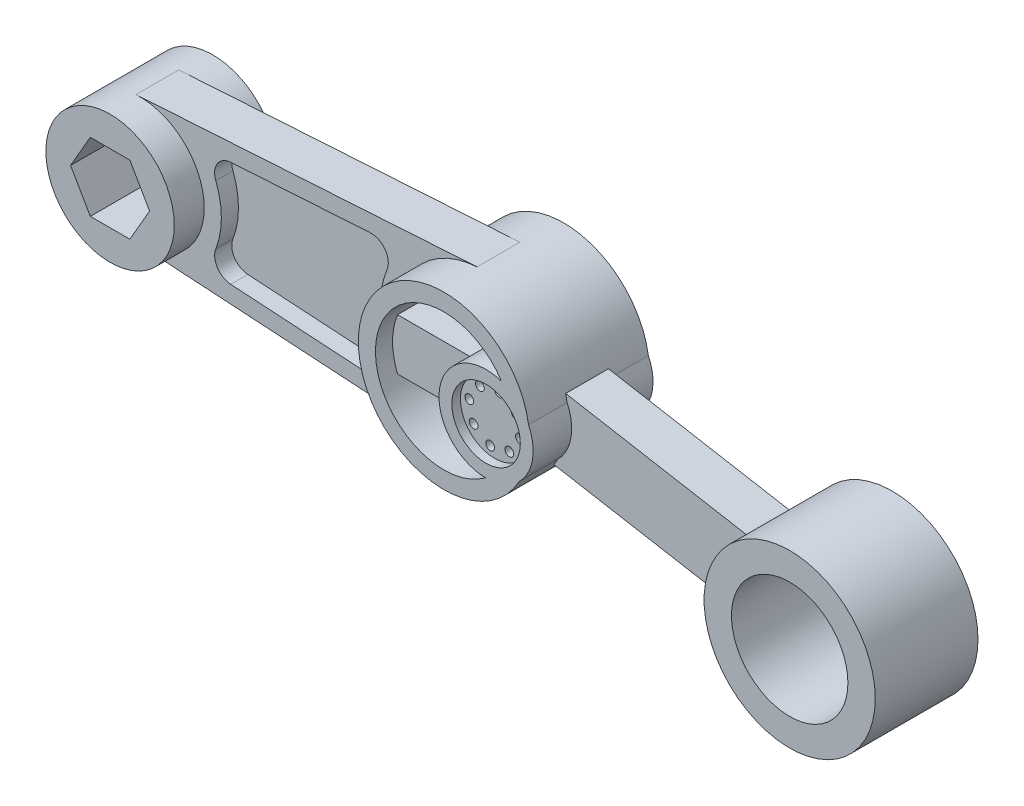
from build123d import *
from build123d.topology import SkipClean

# Parameters (mm, degrees)
LEFT_ARM_DEPTH                = 12.5
SKETCH2_R                     = 37.5
LEFT_BOSS_DEPTH               = 30
LEFT_HEX_DEPTH                = 262.916017
LEFT_HEX_DEPTH_BACK           = 262.916017
SKETCH3_R                     = 50
CENTRE_BOSS_DEPTH             = 35
SKETCH5_W                     = 25
SKETCH5_H                     = 40
RIGHT_ARM_DEPTH               = 200
SKETCH7_R                     = 50
RIGHT_BOSS_DEPTH              = 30
SKETCH8_R                     = 34
RIGHT_BOSS_HOLE_DEPTH         = 460.541879
SKETCH9_R                     = 40
CENTRE_HOLE_DEPTH             = 461.27572
SKETCH10_R                    = 27.5
CENTRE_BLOB_DEPTH             = 35
CENTRE_BEAM_REACH             = 265.428
SKETCH11_W                    = 50
SKETCH11_H                    = 30
CENTRE_BEAM_DIRECTION_2_REACH = 265.428
SKETCH12_R                    = 20
CUT_EXTRUDE4_DEPTH            = 5
F_1_4_20_TAPPED_HOLE1_D       = 5.1054
CIRPATTERN1_COUNT             = 8
CUT_OUT_DEPTH                 = 10
FILLET1_R                     = 10
FILLET1_OF_MIRROR2_R          = 10


with BuildPart() as part:
    # Sketch1 → LEFT_ARM (new, symmetric)
    with BuildSketch(Plane.XY):
        with BuildLine():
            Line((-2.34375, 37.426686), (196.875, 49.902248))
            ThreePointArc((196.875, 49.902248), (250, 0), (196.875, -49.902248))
            Line((196.875, -49.902248), (-2.34375, -37.426686))
            ThreePointArc((-2.34375, -37.426686), (-37.5, 0), (-2.34375, 37.426686))
        make_face()
    extrude(amount=LEFT_ARM_DEPTH, both=True)

    # Sketch2 → LEFT_Boss (add, symmetric)
    with SkipClean():  # the faces are left unmerged after this step: merging them gives an invalid solid
        with BuildSketch(Plane.XY):
            Circle(SKETCH2_R)
        extrude(amount=LEFT_BOSS_DEPTH, both=True)

    # Sketch4 → LEFT_Hex (cut, two sides: drawn at the far end of the back side and taken through both)
    with SkipClean():  # the faces are left unmerged after this step: merging them gives an invalid solid
        with BuildSketch(Plane.XY.offset(30).offset(-LEFT_HEX_DEPTH_BACK)):
            Polygon((23.094011, 0), (11.547005, 20), (-11.547005, 20), (-23.094011, 0), (-11.547005, -20), (11.547005, -20), align=None)
        extrude(amount=LEFT_HEX_DEPTH + LEFT_HEX_DEPTH_BACK, mode=Mode.SUBTRACT)

    # Sketch3 → CENTRE_Boss (add, symmetric)
    with SkipClean():  # the faces are left unmerged after this step: merging them gives an invalid solid
        with BuildSketch(Plane.XY):
            with Locations((200, 0)):
                Circle(SKETCH3_R)
        extrude(amount=CENTRE_BOSS_DEPTH, both=True)

    # Sketch5 → RIGHT_ARM (add)
    with SkipClean():  # the faces are left unmerged after this step: merging them gives an invalid solid
        with BuildSketch(Plane(origin=(193.969262, -34.202014, 0), x_dir=(0, 0, -1), z_dir=(0.984807753012208, -0.17364817766693072, 0))):
            with Locations((0, 34.729636)):
                Rectangle(SKETCH5_W, SKETCH5_H)
        extrude(amount=RIGHT_ARM_DEPTH)

    # Sketch7 → RIGHT_Boss (add, symmetric)
    with SkipClean():  # the faces are left unmerged after this step: merging them gives an invalid solid
        with BuildSketch(Plane.XY):
            with Locations((396.961551, -34.729636)):
                Circle(SKETCH7_R)
        extrude(amount=RIGHT_BOSS_DEPTH, both=True)

    # Sketch8 → RIGHT_Boss_Hole (cut, through all)
    with SkipClean():  # the faces are left unmerged after this step: merging them gives an invalid solid
        with BuildSketch(Plane.XY.offset(30)):
            with Locations((396.961551, -34.729636)):
                Circle(SKETCH8_R)
        extrude(amount=-RIGHT_BOSS_HOLE_DEPTH, mode=Mode.SUBTRACT)

    # Sketch9 → CENTRE_Hole (cut, through all)
    with SkipClean():  # the faces are left unmerged after this step: merging them gives an invalid solid
        with BuildSketch(Plane.XY.offset(35)):
            with Locations((200, 0)):
                Circle(SKETCH9_R)
        extrude(amount=-CENTRE_HOLE_DEPTH, mode=Mode.SUBTRACT)

    # Sketch10 → CENTRE_Blob (add, symmetric)
    with SkipClean():  # the faces are left unmerged after this step: merging them gives an invalid solid
        with BuildSketch(Plane.XY):
            with Locations((224.620194, -4.341204)):
                Circle(SKETCH10_R)
        extrude(amount=CENTRE_BLOB_DEPTH, both=True)

    # Sketch11 → CENTRE_Beam (add, up to next)
    with BuildSketch(Plane(origin=(200, 0, 0), x_dir=(0, 0, -1), z_dir=(1, 0, 0)), mode=Mode.PRIVATE) as centre_beam_sk1:
        Rectangle(SKETCH11_W, SKETCH11_H)
    centre_beam_tool1 = extrude(centre_beam_sk1.sketch, amount=CENTRE_BEAM_REACH, mode=Mode.PRIVATE) - part.part
    add(centre_beam_tool1.solids().sort_by_distance((200, 0, 0))[0])

    # Sketch11 → CENTRE_Beam direction 2 (add, up to next)
    with BuildSketch(Plane(origin=(200, 0, 0), x_dir=(0, 0, -1), z_dir=(1, 0, 0)), mode=Mode.PRIVATE) as centre_beam_direction_2_sk1:
        Rectangle(SKETCH11_W, SKETCH11_H)
    centre_beam_direction_2_tool1 = extrude(centre_beam_direction_2_sk1.sketch, amount=-CENTRE_BEAM_DIRECTION_2_REACH, mode=Mode.PRIVATE) - part.part
    add(centre_beam_direction_2_tool1.solids().sort_by_distance((200, 0, 0))[0])

    # Sketch12 → Cut-Extrude4 (cut)
    with SkipClean():  # the faces are left unmerged after this step: merging them gives an invalid solid
        with BuildSketch(Plane.XY.offset(35)):
            with Locations((224.620194, -4.341204)):
                Circle(SKETCH12_R)
        cut_extrude4 = extrude(amount=-CUT_EXTRUDE4_DEPTH, mode=Mode.SUBTRACT)

    # 1/4-20 Tapped Hole1 (through all)
    with Locations(Plane.XY.offset(30)):
        with Locations((209.848078, -1.736482)):
            f_1_4_20_tapped_hole1 = Hole(F_1_4_20_TAPPED_HOLE1_D / 2)

    # CirPattern1: 1/4-20 Tapped Hole1 ×8 about axis
    with SkipClean():  # the faces are left unmerged after this step: merging them gives an invalid solid
        cirpattern1_axis = Axis((224.620194, -4.341204, 0), (0, 0, 1))
        for i in range(1, CIRPATTERN1_COUNT):
            add(f_1_4_20_tapped_hole1.rotate(cirpattern1_axis, i * 360 / CIRPATTERN1_COUNT), mode=Mode.SUBTRACT)

    # Mirror1: Cut-Extrude4 across plane
    with SkipClean():  # the faces are left unmerged after this step: merging them gives an invalid solid
        add(cut_extrude4.mirror(Plane.XY), mode=Mode.SUBTRACT)

    # Sketch15 → Cut_OUT (cut)
    with SkipClean():  # the faces are left unmerged after this step: merging them gives an invalid solid
        with BuildSketch(Plane.XY.offset(12.5)):
            with BuildLine():
                Line((152.866072, 37.126714), (36.935365, 29.866851))
                ThreePointArc((36.935365, 29.866851), (47.5, 0), (36.935365, -29.866851))
                Line((36.935365, -29.866851), (152.866072, -37.126714))
                ThreePointArc((152.866072, -37.126714), (140, 0), (152.866072, 37.126714))
            make_face()
        cut_out = extrude(amount=-CUT_OUT_DEPTH, mode=Mode.SUBTRACT)

    # Fillet1
    fillet1_edges = [part.edges().sort_by_distance(p)[0] for p in [
        (36.935365, -29.866851, 7.5),
        (36.935365, 29.866851, 7.5),
        (152.866072, 37.126714, 7.5),
        (152.866072, -37.126714, 7.5),
    ]]
    fillet(fillet1_edges, radius=FILLET1_R)

    # Mirror2: Cut_OUT across plane
    with SkipClean():  # the faces are left unmerged after this step: merging them gives an invalid solid
        add(cut_out.mirror(Plane.XY), mode=Mode.SUBTRACT)

    # Fillet1 of Mirror2
    fillet1_of_mirror2_edges = [part.edges().sort_by_distance(p)[0] for p in [
        (36.935365, -29.866851, -7.5),
        (36.935365, 29.866851, -7.5),
        (152.866072, 37.126714, -7.5),
        (152.866072, -37.126714, -7.5),
    ]]
    fillet(fillet1_of_mirror2_edges, radius=FILLET1_OF_MIRROR2_R)


solid = part.part
